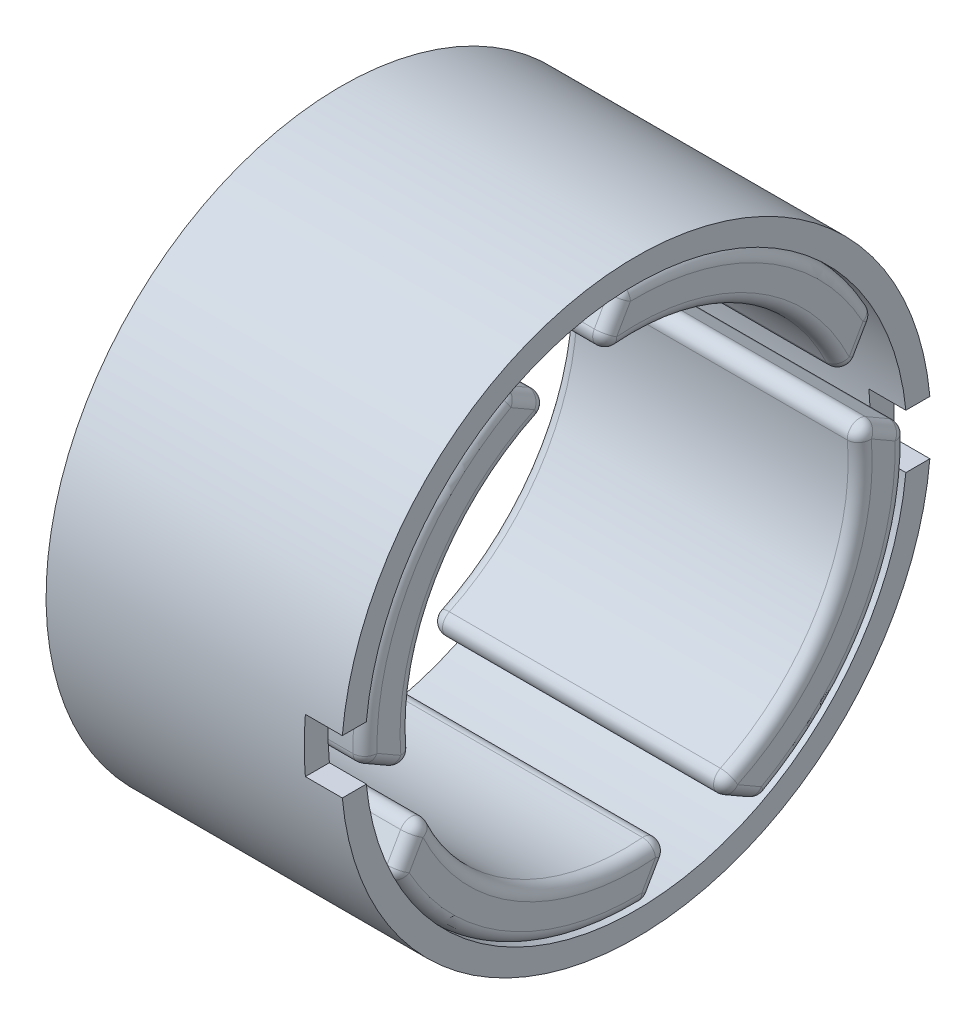
from build123d import *

# Parameters (mm, degrees)
SKETCH2_R               = 25
SKETCH2_R_2             = 22.9743
BOSS_EXTRUDE1_DEPTH     = 25
CUT_EXTRUDE1_DEPTH      = 44.301270189
CUT_EXTRUDE1_DEPTH_BACK = 44.301270189
SKETCH3_W               = 3.1306
SKETCH3_H               = 4.572
BOSS_EXTRUDE2_DEPTH     = 25
FILLET1_R               = 1.016
CIRPATTERN1_COUNT       = 4


with BuildPart() as part:
    # Sketch2 → Boss-Extrude1 (new body)
    with BuildSketch(Plane(origin=(0, 0, 0), x_dir=(0, 0, -1), z_dir=(1, 0, 0))):
        Circle(SKETCH2_R)
        Circle(SKETCH2_R_2, mode=Mode.SUBTRACT)
    extrude(amount=BOSS_EXTRUDE1_DEPTH)

    # Sketch3 → Cut-Extrude1 (cut, two sides: drawn at the far end of the back side and taken through both)
    with BuildSketch(Plane.XY.offset(-CUT_EXTRUDE1_DEPTH_BACK)):
        with Locations((23.4347, 0)):
            Rectangle(SKETCH3_W, SKETCH3_H)
    extrude(amount=CUT_EXTRUDE1_DEPTH + CUT_EXTRUDE1_DEPTH_BACK, mode=Mode.SUBTRACT)


with BuildPart() as body_2:
    # Sketch4 → Boss-Extrude2 (new body)
    with BuildSketch(Plane(origin=(0, 0, 0), x_dir=(0, 0, -1), z_dir=(1, 0, 0))):
        with BuildLine():
            Line((-22.948744701, -1.083317659), (-18.650524021, -3.556))
            ThreePointArc((-18.650524021, -3.556), (-16.457521644, 9.46769051), (-6.301362486, 17.910332579))
            Line((-6.301362486, 17.910332579), (-10.599583165, 20.38301492))
            ThreePointArc((-10.599583165, 20.38301492), (-19.914151608, 11.456222163), (-22.948744701, -1.083317659))
        make_face()
    extrude(amount=BOSS_EXTRUDE2_DEPTH)

    # Fillet1
    fillet1_edges = [body_2.edges().sort_by_distance(p)[0] for p in [
        (12.5, -1.083317659, 22.948744701),
        (0, -2.31965883, 20.799634361),
        (12.5, -3.556, 18.650524021),
        (0, 9.46769051, 16.457521644),
        (12.5, 17.910332579, 6.301362486),
        (0, 19.146673749, 8.450472825),
        (25, 19.146673749, 8.450472825),
        (25, 11.456222163, 19.914151608),
        (25, -2.31965883, 20.799634361),
        (25, 9.46769051, 16.457521644),
        (12.5, 20.38301492, 10.599583165),
        (0, 11.456222163, 19.914151608),
    ]]
    fillet(fillet1_edges, radius=FILLET1_R)


with BuildPart() as cirpattern1_1:
    # CirPattern1: pattern copy
    add(body_2.part.rotate(Axis((0, 0, 0), (1, 0, 0)), 1 * 360 / CIRPATTERN1_COUNT))


with BuildPart() as cirpattern1_2:
    # CirPattern1: pattern copy
    add(body_2.part.rotate(Axis((0, 0, 0), (1, 0, 0)), 2 * 360 / CIRPATTERN1_COUNT))


with BuildPart() as cirpattern1_3:
    # CirPattern1: pattern copy
    add(body_2.part.rotate(Axis((0, 0, 0), (1, 0, 0)), 3 * 360 / CIRPATTERN1_COUNT))


solid = Compound([part.part, body_2.part, cirpattern1_1.part, cirpattern1_2.part, cirpattern1_3.part])
